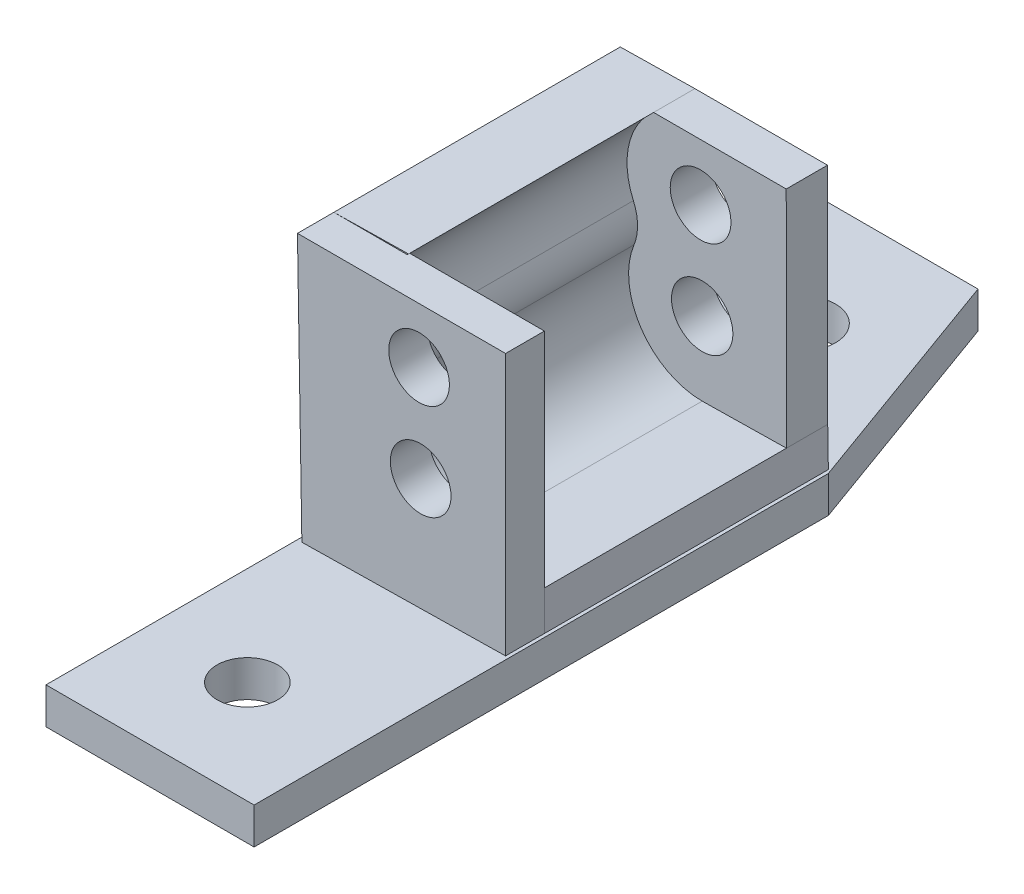
from build123d import *

# Parameters (mm, degrees)
BOSS_EXTRUDE1_DEPTH      = 29.972
BOSS_EXTRUDE2_DEPTH      = 3.81
BOSS_EXTRUDE2_DEPTH_BACK = 0.254
SKETCH4_R                = 3.175
BOSS_EXTRUDE3_START      = -4.318
SKETCH6_R                = 3.177814596
SKETCH6_R_2              = 3.208783605
BOSS_EXTRUDE3_DEPTH      = 4.318
SKETCH7_R                = 3.171284257
SKETCH7_R_2              = 3.52301874
BOSS_EXTRUDE4_DEPTH      = 3.81


with BuildPart() as part:
    # Sketch1 → Boss-Extrude1 (new body)
    with BuildSketch(Plane.XY):
        with BuildLine():
            Line((-428.277811685, 108.881459693), (-428.34538043, 112.94489795))
            Line((-428.34538043, 112.94489795), (-437.164813366, 112.799308879))
            ThreePointArc((-437.164813366, 112.799308879), (-443.55265803, 116.199292583), (-444.299822548, 123.396944549))
            ThreePointArc((-444.299822548, 123.396944549), (-443.927333751, 125.391172793), (-444.36491239, 127.372136984))
            ThreePointArc((-444.36491239, 127.372136984), (-444.826279861, 132.255084277), (-442.244950431, 136.42554859))
            Line((-442.244950431, 136.42554859), (-450.05783618, 136.295632285))
            Line((-450.05783618, 136.295632285), (-449.596085914, 108.526969495))
            Line((-449.596085914, 108.526969495), (-428.277811685, 108.881459693))
        make_face()
    extrude(amount=-BOSS_EXTRUDE1_DEPTH)

    # Sketch4 → Boss-Extrude2 (add, two sides: drawn at the far end of the back side and taken through both)
    with BuildSketch(Plane.XY.offset(-BOSS_EXTRUDE2_DEPTH_BACK)):
        Polygon((-450.05783618, 136.295632285), (-449.596085914, 108.526969495), (-428.277811685, 108.881459693), (-428.277811685, 136.295632285), align=None)
        with Locations((-437.164813366, 120.5)):
            Circle(SKETCH4_R, mode=Mode.SUBTRACT)
        with Locations((-437.331098026, 130.5)):
            Circle(SKETCH4_R, mode=Mode.SUBTRACT)
    extrude(amount=BOSS_EXTRUDE2_DEPTH + BOSS_EXTRUDE2_DEPTH_BACK)

    # Sketch6 → Boss-Extrude3 (add)
    with BuildSketch(Plane(origin=(0, 0, -29.972), x_dir=(-1, 0, 0), z_dir=(0, 0, -1)).offset(BOSS_EXTRUDE3_START)):
        with BuildLine():
            Line((442.244950431, 136.42554859), (428.367659487, 136.42554859))
            Line((428.367659487, 136.42554859), (428.34538043, 112.94489795))
            Line((428.34538043, 112.94489795), (437.164813366, 112.799308879))
            ThreePointArc((437.164813366, 112.799308879), (443.55265803, 116.199292583), (444.299822548, 123.396944549))
            ThreePointArc((444.299822548, 123.396944549), (443.927333751, 125.391172793), (444.36491239, 127.372136984))
            ThreePointArc((444.36491239, 127.372136984), (444.826279861, 132.255084277), (442.244950431, 136.42554859))
        make_face()
        with Locations((437.331098026, 130.5)):
            Circle(SKETCH6_R, mode=Mode.SUBTRACT)
        with Locations((437.164813366, 120.5)):
            Circle(SKETCH6_R_2, mode=Mode.SUBTRACT)
    extrude(amount=BOSS_EXTRUDE3_DEPTH)


with BuildPart() as body_2:
    # Sketch7 → Boss-Extrude4 (new body)
    with BuildSketch(Plane(origin=(0.013089851, 108.472713295, 0), x_dir=(0.9999999927188763, -0.00012067413737196964, 0), z_dir=(0.00012067413737196965, 0.9999999927188764, 3.026052666249046e-15))):
        Polygon((-428.294255925, 29.972), (-428.294255925, -3.81), (-428.294255925, -30.122888974), (-450.074280261, -30.122888974), (-450.074280261, -3.81), (-450.074280261, 29.972), (-460.142837278, 54.522803602), (-437.18058237, 54.522803602), align=None)
        with Locations(Location((-439.763703675, -19.359151609, 0), (0, 0, 180))):
            Circle(SKETCH7_R, mode=Mode.SUBTRACT)
        with Locations(Location((-443.286722414, 42.185510265, 0), (0, 0, 180))):
            Circle(SKETCH7_R_2, mode=Mode.SUBTRACT)
    extrude(amount=-BOSS_EXTRUDE4_DEPTH)


solid = Compound([part.part, body_2.part])
